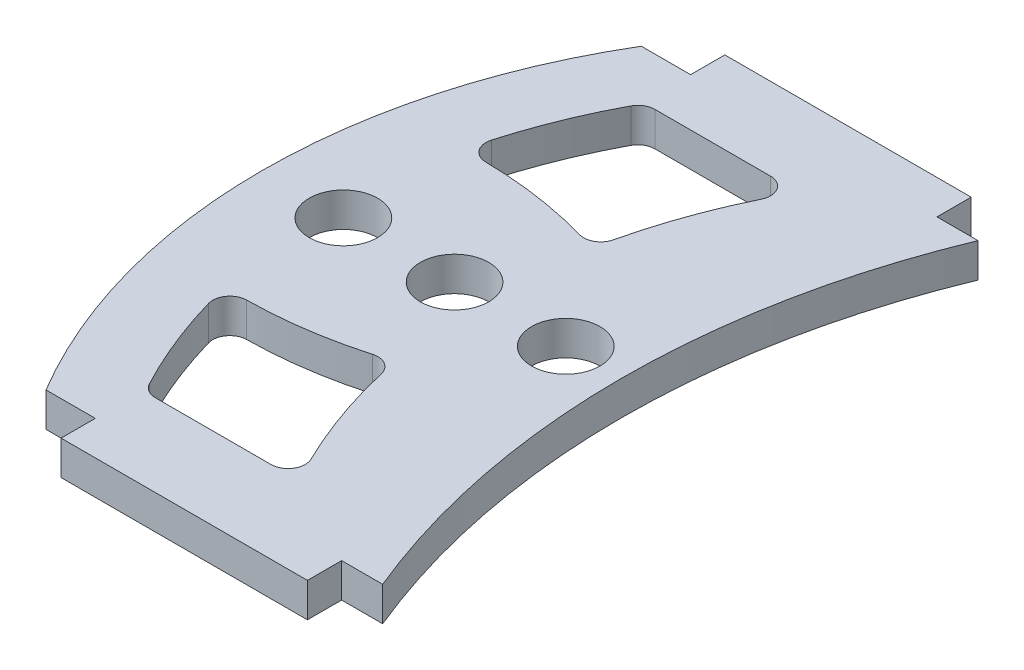
from build123d import *

# Parameters (mm, degrees)
SKETCH2_R           = 2
BOSS_EXTRUDE1_DEPTH = 2


with BuildPart() as part:
    # Sketch2 → Boss-Extrude1 (new body)
    with BuildSketch(Plane(origin=(0, 0, 0), x_dir=(1, 0, 0), z_dir=(0, 1, 0))):
        with BuildLine():
            Line((7.961413572, 38.398358915), (10.842933693, 38.398358915))
            Line((10.842933693, 38.398358915), (10.842933693, 40.398358915))
            Line((10.842933693, 40.398358915), (25.242933693, 40.398358915))
            Line((25.242933693, 40.398358915), (25.242933693, 38.398358915))
            Line((25.242933693, 38.398358915), (27.643012608, 38.398358915))
            ThreePointArc((27.643012608, 38.398358915), (24.192745703, 20.998358915), (27.643012608, 3.598358915))
            Line((27.643012608, 3.598358915), (25.242933693, 3.598358915))
            Line((25.242933693, 3.598358915), (25.242933693, 1.598358915))
            Line((25.242933693, 1.598358915), (10.842933693, 1.598358915))
            Line((10.842933693, 1.598358915), (10.842933693, 3.598358915))
            Line((10.842933693, 3.598358915), (7.961413572, 3.598358915))
            ThreePointArc((7.961413572, 3.598358915), (3.171685738, 20.998358915), (7.961413572, 38.398358915))
        make_face()
        with Locations(Location((14.44517784, 20.998358915, 0), (0, 0, 270))):
            Circle(SKETCH2_R, mode=Mode.SUBTRACT)
        with Locations(Location((7.94517784, 20.998358915, 0), (0, 0, 270))):
            Circle(SKETCH2_R, mode=Mode.SUBTRACT)
        with Locations(Location((20.94517784, 20.998358915, 0), (0, 0, 270))):
            Circle(SKETCH2_R, mode=Mode.SUBTRACT)
        with BuildLine():
            Line((11.558407931, 6.398358915), (18.314191235, 6.398358915))
            ThreePointArc((18.314191235, 6.398358915), (19.162339122, 6.868599384), (19.21282009, 7.837068593))
            ThreePointArc((19.21282009, 7.837068593), (17.901234233, 10.95935639), (16.949906233, 14.209573857))
            ThreePointArc((16.949906233, 14.209573857), (16.483665754, 14.844744909), (15.702159941, 14.945099841))
            ThreePointArc((15.702159941, 14.945099841), (12.522935582, 14.264828801), (9.281614764, 14.011697267))
            ThreePointArc((9.281614764, 14.011697267), (8.491111108, 13.609072345), (8.331792637, 12.73636364))
            ThreePointArc((8.331792637, 12.73636364), (9.351564099, 9.771568101), (10.675191455, 6.929393398))
            ThreePointArc((10.675191455, 6.929393398), (11.04312428, 6.54133922), (11.558407931, 6.398358915))
        make_face(mode=Mode.SUBTRACT)
        with BuildLine():
            Line((11.558407931, 35.598358915), (18.314191235, 35.598358915))
            ThreePointArc((18.314191235, 35.598358915), (19.162339122, 35.128118447), (19.21282009, 34.159649238))
            ThreePointArc((19.21282009, 34.159649238), (17.901234233, 31.03736144), (16.949906233, 27.787143973))
            ThreePointArc((16.949906233, 27.787143973), (16.483665754, 27.151972922), (15.702159941, 27.05161799))
            ThreePointArc((15.702159941, 27.05161799), (12.522935582, 27.73188903), (9.281614764, 27.985020563))
            ThreePointArc((9.281614764, 27.985020563), (8.491111108, 28.387645486), (8.331792637, 29.26035419))
            ThreePointArc((8.331792637, 29.26035419), (9.351564099, 32.225149729), (10.675191455, 35.067324432))
            ThreePointArc((10.675191455, 35.067324432), (11.04312428, 35.455378611), (11.558407931, 35.598358915))
        make_face(mode=Mode.SUBTRACT)
    extrude(amount=BOSS_EXTRUDE1_DEPTH)


solid = part.part
